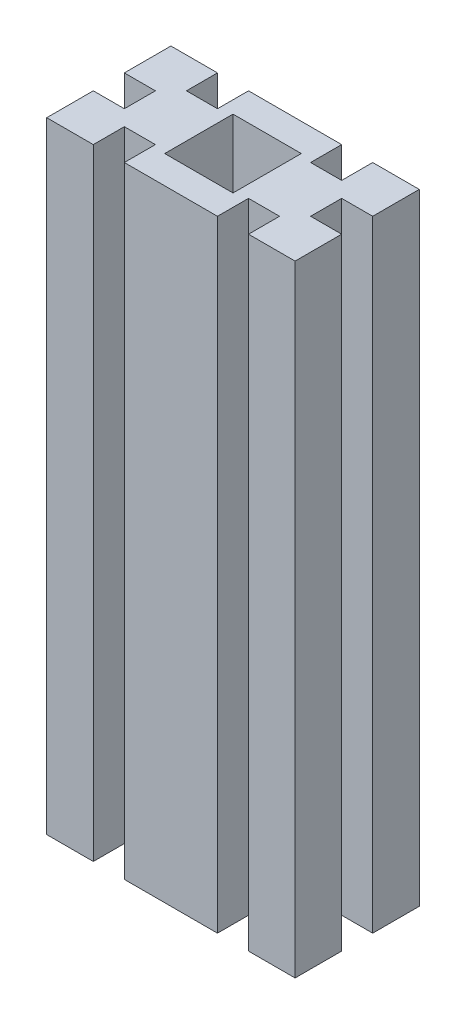
from build123d import *

# Parameters (mm, degrees)
SKETCH1_W       = 40
SKETCH1_H       = 20
BODY_DEPTH      = 100
SKETCH2_W       = 5
SKETCH2_H       = 5
SKETCH2_W_2     = 11
SKETCH2_H_2     = 11
PROFILAGE_DEPTH = 103.46950766


with BuildPart() as part:
    # Sketch1 → Body (new body)
    with BuildSketch(Plane(origin=(0, 0, 0), x_dir=(1, 0, 0), z_dir=(0, 1, 0))):
        Rectangle(SKETCH1_W, SKETCH1_H)
    extrude(amount=BODY_DEPTH)

    # Sketch2 → Profilage (cut, through all)
    with BuildSketch(Plane(origin=(0, 100, 0), x_dir=(1, 0, 0), z_dir=(0, 1, 0))):
        with Locations((-10, 7.5)):
            Rectangle(SKETCH2_W, SKETCH2_H)
        with Locations((-17.5, 0)):
            Rectangle(SKETCH2_W, SKETCH2_H)
        with Locations((-10, -7.5)):
            Rectangle(SKETCH2_W, SKETCH2_H)
        with Locations((10, -7.5)):
            Rectangle(SKETCH2_W, SKETCH2_H)
        with Locations((17.5, 0)):
            Rectangle(SKETCH2_W, SKETCH2_H)
        with Locations((10, 7.5)):
            Rectangle(SKETCH2_W, SKETCH2_H)
        Rectangle(SKETCH2_W_2, SKETCH2_H_2)
    extrude(amount=-PROFILAGE_DEPTH, mode=Mode.SUBTRACT)


solid = part.part
